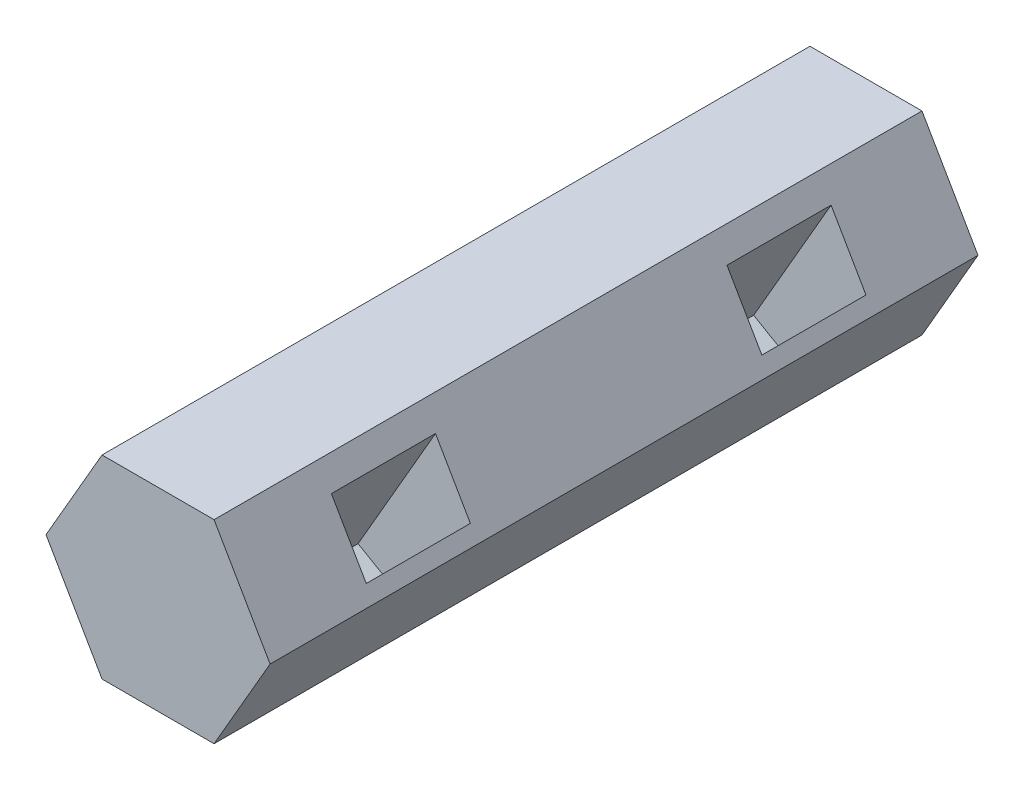
from build123d import *

# Parameters (mm, degrees)
BOSS_EXTRU_1_DEPTH      = 34
ENL_V_MAT_EXTRU_1_DEPTH = 5


with BuildPart() as part:
    # Esquisse1 → Boss.-Extru.1 (new body)
    with BuildSketch(Plane.XY):
        Polygon((-2.690598923, 4.660254038), (-5.381197846, 0), (-2.690598923, -4.660254038), (2.690598923, -4.660254038), (5.381197846, 0), (2.690598923, 4.660254038), align=None)
    extrude(amount=BOSS_EXTRU_1_DEPTH)

    # Esquisse2 → Enlèv. mat.-Extru.1 (cut)
    with BuildSketch(Plane.XY.offset(5)):
        Polygon((3.657319172, 4.134662626), (-0.392671517, -2.880127019), (2.118802154, -4.330127019), (6.168792843, 2.684662626), align=None)
    enl_v_mat_extru_1 = extrude(amount=ENL_V_MAT_EXTRU_1_DEPTH, mode=Mode.SUBTRACT)

    # Symétrie1: Enlèv. mat.-Extru.1 across plane
    add(enl_v_mat_extru_1.mirror(Plane(origin=(0, 0, 17), x_dir=(1, 0, 0), z_dir=(0, 0, -1))), mode=Mode.SUBTRACT)


solid = part.part
